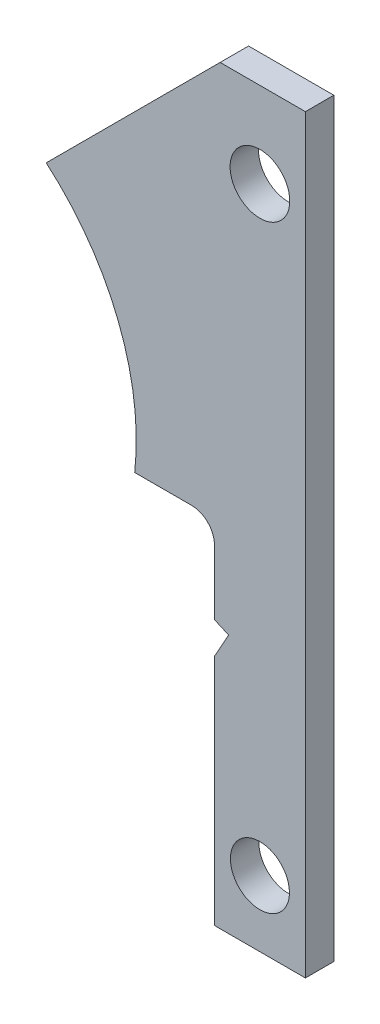
from build123d import *

# Parameters (mm, degrees)
MODEL_R             = 5.191903136
MODEL_R_2           = 5.25
BOSS_EXTRUDE1_DEPTH = 5
BOSS_EXTRUDE2_DEPTH = 5
SKETCH3_R           = 45.25
CUT_EXTRUDE1_DEPTH  = 6


with BuildPart() as part:
    # Model → Boss-Extrude1 (new body)
    with BuildSketch(Plane.XY):
        with BuildLine():
            Line((869.6, 129.800004709), (854.6, 129.800004709))
            Line((854.6, 129.800004709), (854.6, 124.800004709))
            ThreePointArc((854.6, 124.800004709), (842.940279, 95.005240735), (815.123335737, 79.19718198))
            ThreePointArc((815.123335737, 79.19718198), (819.577050566, 70.004649675), (820.028101645, 59.800004709))
            Line((820.028101645, 59.800004709), (849.60000149, 59.800004709))
            ThreePointArc((849.60000149, 59.800004709), (852.428428615, 58.628431833), (853.60000149, 55.800004709))
            Line((853.60000149, 55.800004709), (853.60000149, 44.400154403))
            Line((853.60000149, 44.400154403), (856.099999799, 43.300004388))
            Line((856.099999799, 43.300004388), (853.60000149, 38.829377357))
            Line((853.60000149, 38.829377357), (853.60000149, -2.199993903))
            Line((853.60000149, -2.199993903), (869.6, -2.199993903))
            Line((869.6, -2.199993903), (869.6, 129.800004709))
        make_face()
        with Locations((861.6, 9.391497171)):
            Circle(MODEL_R, mode=Mode.SUBTRACT)
        with Locations((861.6, 114.800004709)):
            Circle(MODEL_R_2, mode=Mode.SUBTRACT)
    extrude(amount=BOSS_EXTRUDE1_DEPTH)

    # Sketch4 → Boss-Extrude2 (add)
    with BuildSketch(Plane.XY):
        Polygon((854.6, 129.800004709), (799.700462268, 74.900466976), (857.081865671, 78.451748184), (855.676639351, 119.436170701), (858.647890459, 128.484980891), align=None)
    extrude(amount=BOSS_EXTRUDE2_DEPTH)

    # Sketch3 → Cut-Extrude1 (cut)
    with BuildSketch(Plane(origin=(0, 0, 0), x_dir=(-1, 0, 0), z_dir=(0, 0, -1))):
        with Locations((-794.6, 64.800004709)):
            Circle(SKETCH3_R)
    extrude(amount=-CUT_EXTRUDE1_DEPTH, mode=Mode.SUBTRACT)


solid = part.part
